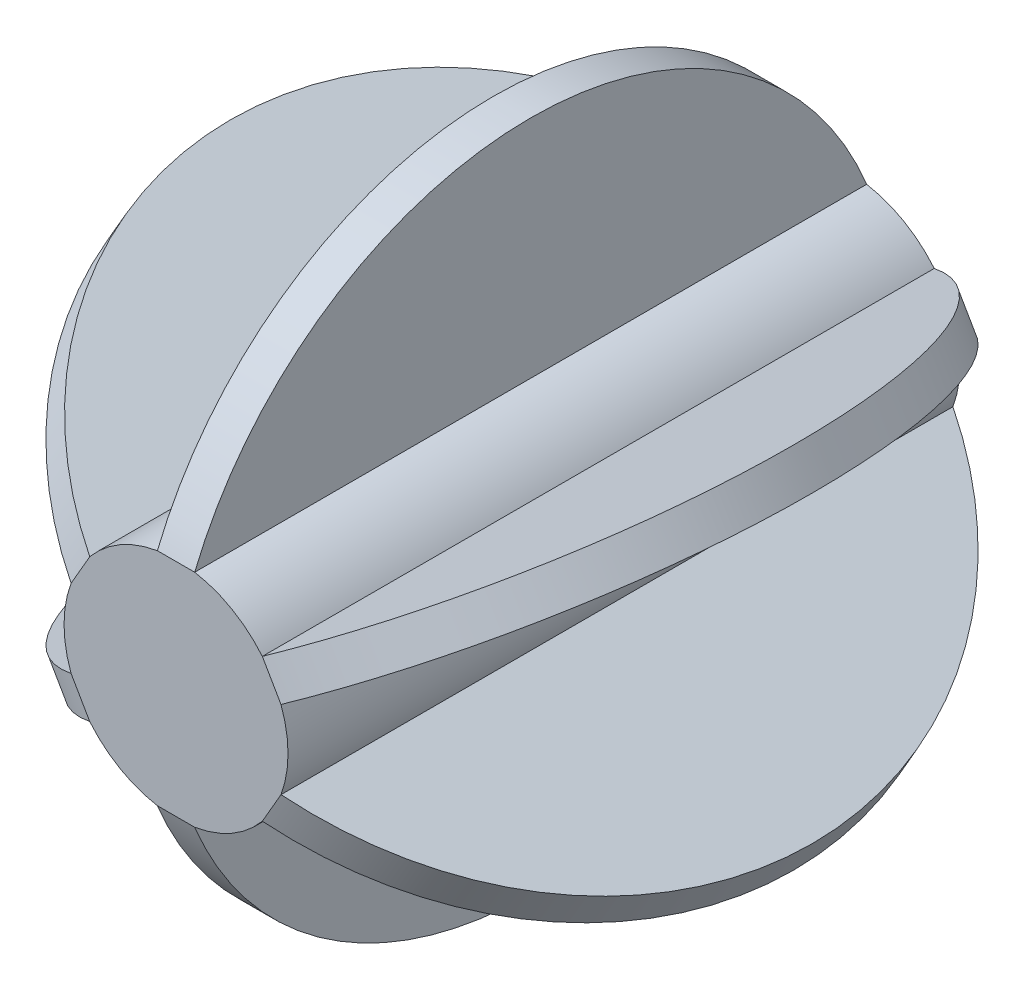
from build123d import *

# Parameters (mm, degrees)
BOSS_EXTRUDE1_DEPTH = 90
CUT_EXTRUDE2_DEPTH  = 100
CIRPATTERN3_COUNT   = 6


with BuildPart() as part:
    # Sketch1 → Boss-Extrude1 (new body)
    with BuildSketch(Plane.XY):
        with BuildLine():
            Line((-14.058688457, 5.230036219), (-40.22114317, 20.334936491))
            Line((-40.22114317, 20.334936491), (-37.72114317, 24.665063509))
            Line((-37.72114317, 24.665063509), (-11.558688457, 9.560163238))
            ThreePointArc((-11.558688457, 9.560163238), (-9.682458366, 11.456439237), (-7.5, 12.990381057))
            Line((-7.5, 12.990381057), (0, 0))
            Line((0, 0), (-15, 0))
            ThreePointArc((-15, 0), (-14.762796599, 2.657035297), (-14.058688457, 5.230036219))
        make_face()
    boss_extrude1 = extrude(amount=BOSS_EXTRUDE1_DEPTH)

    # Sketch2 → Cut-Extrude2 (cut)
    with BuildSketch(Plane(origin=(1.25, 2.165063509, 0), x_dir=(0.8660254037844417, -0.4999999999999949, 0), z_dir=(0.4999999999999949, 0.8660254037844417, 0))):
        with BuildLine():
            Line((-45, 0), (-45, -45))
            ThreePointArc((-45, -45), (-36.747126088, -17.900036675), (-14.790199458, 0))
            Line((-14.790199458, 0), (-45, 0))
        make_face()
        with BuildLine():
            Line((-45, -90), (-14.790199458, -90))
            ThreePointArc((-14.790199458, -90), (-36.747126088, -72.099963325), (-45, -45))
            Line((-45, -45), (-45, -90))
        make_face()
    cut_extrude2 = extrude(amount=-CUT_EXTRUDE2_DEPTH, mode=Mode.SUBTRACT)

    # CirPattern3: Boss-Extrude1, Cut-Extrude2 ×6 about axis
    cirpattern3_axis = Axis((0, 0, 90), (0, 0, -1))
    add([boss_extrude1.rotate(cirpattern3_axis, i * 360 / CIRPATTERN3_COUNT) for i in range(1, CIRPATTERN3_COUNT)])
    add([cut_extrude2.rotate(cirpattern3_axis, i * 360 / CIRPATTERN3_COUNT) for i in range(1, CIRPATTERN3_COUNT)], mode=Mode.SUBTRACT)


solid = part.part
